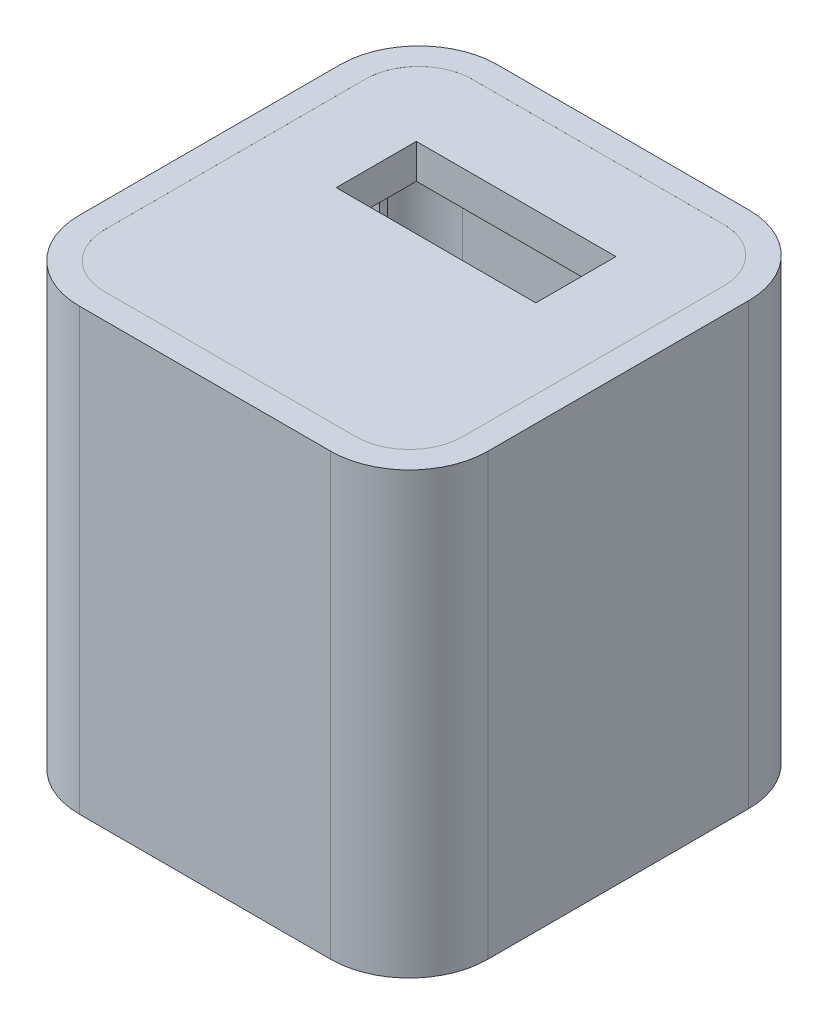
from build123d import *

# Parameters (mm, degrees)
RESSALTO_EXTRUS_O1_DEPTH = 28
CASCA1_T                 = -2.2
ESBO_O2_W                = 12.7
ESBO_O2_H                = 5.1
CORTE_EXTRUS_O1_DEPTH    = 5
CORTE_EXTRUS_O2_DEPTH    = 0.001
CORTE_EXTRUS_O3_START    = -2
CORTE_EXTRUS_O3_DEPTH    = 2
ESBO_O5_W                = 1.3
ESBO_O5_H                = 0.5
RESSALTO_EXTRUS_O2_DEPTH = 18.3


with BuildPart() as part:
    # Esboço1 → Ressalto-extrusão1 (new body)
    with BuildSketch(Plane(origin=(0, 0, 0), x_dir=(1, 0, 0), z_dir=(0, 1, 0))):
        with BuildLine():
            Line((-8, -13.3), (8, -13.3))
            ThreePointArc((8, -13.3), (11.535533906, -11.835533906), (13, -8.3))
            Line((13, -8.3), (13, 8.3))
            ThreePointArc((13, 8.3), (11.535533906, 11.835533906), (8, 13.3))
            Line((8, 13.3), (-8, 13.3))
            ThreePointArc((-8, 13.3), (-11.535533906, 11.835533906), (-13, 8.3))
            Line((-13, 8.3), (-13, -8.3))
            ThreePointArc((-13, -8.3), (-11.535533906, -11.835533906), (-8, -13.3))
        make_face()
    extrude(amount=RESSALTO_EXTRUS_O1_DEPTH)

    # Casca1
    casca1_openings = [part.faces().sort_by_distance(p)[0] for p in [
        (0, 0, 0),
    ]]
    offset(amount=CASCA1_T, openings=casca1_openings, kind=Kind.INTERSECTION)

    # Esboço2 → Corte-extrusão1 (cut)
    with BuildSketch(Plane(origin=(0, 28, 0), x_dir=(-1, 0, 0), z_dir=(0, 1, 0))):
        with Locations((0, -3.95)):
            Rectangle(ESBO_O2_W, ESBO_O2_H)
    extrude(amount=-CORTE_EXTRUS_O1_DEPTH, mode=Mode.SUBTRACT)

    # Esboço3 → Corte-extrusão2 (cut)
    with BuildSketch(Plane(origin=(0, 28, 0), x_dir=(1, 0, 0), z_dir=(0, 1, 0))):
        with BuildLine():
            Line((-8, -11.7), (8, -11.7))
            ThreePointArc((8, -11.7), (10.404163056, -10.704163056), (11.4, -8.3))
            Line((11.4, -8.3), (11.4, 8.3))
            ThreePointArc((11.4, 8.3), (10.404163056, 10.704163056), (8, 11.7))
            Line((8, 11.7), (-8, 11.7))
            ThreePointArc((-8, 11.7), (-10.404163056, 10.704163056), (-11.4, 8.3))
            Line((-11.4, 8.3), (-11.4, -8.3))
            ThreePointArc((-11.4, -8.3), (-10.404163056, -10.704163056), (-8, -11.7))
        make_face()
    extrude(amount=-CORTE_EXTRUS_O2_DEPTH, mode=Mode.SUBTRACT)

    # Esboço4 → Corte-extrusão3 (cut)
    with BuildSketch(Plane.XZ.offset(CORTE_EXTRUS_O3_START)):
        with BuildLine():
            Line((-8, -11.7), (8, -11.7))
            ThreePointArc((8, -11.7), (10.404163056, -10.704163056), (11.4, -8.3))
            Line((11.4, -8.3), (11.4, 8.3))
            ThreePointArc((11.4, 8.3), (10.404163056, 10.704163056), (8, 11.7))
            Line((8, 11.7), (-8, 11.7))
            ThreePointArc((-8, 11.7), (-10.404163056, 10.704163056), (-11.4, 8.3))
            Line((-11.4, 8.3), (-11.4, -8.3))
            ThreePointArc((-11.4, -8.3), (-10.404163056, -10.704163056), (-8, -11.7))
        make_face()
    extrude(amount=CORTE_EXTRUS_O3_DEPTH, mode=Mode.SUBTRACT)

    # Esboço5 → Ressalto-extrusão2 (add)
    with BuildSketch(Plane.XZ.offset(-25.8)):
        with Locations((10.15, -7.55)):
            Rectangle(ESBO_O5_W, ESBO_O5_H)
    ressalto_extrus_o2 = extrude(amount=RESSALTO_EXTRUS_O2_DEPTH)

    # Espelhar1: Ressalto-extrusão2 across plane
    add(ressalto_extrus_o2.mirror(Plane(origin=(0, 0, 0), x_dir=(0, 0, 1), z_dir=(1, 0, 0))))


solid = part.part
